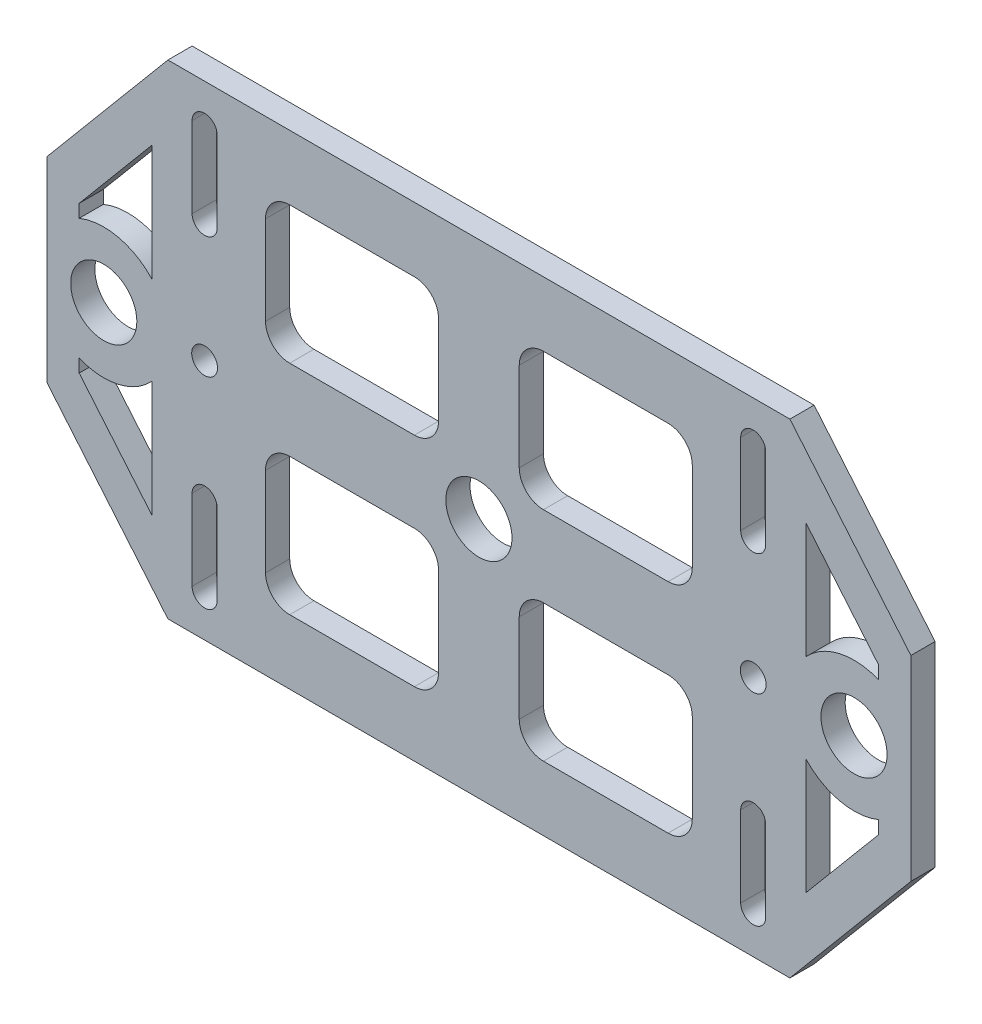
from build123d import *

# Parameters (mm, degrees)
SKETCH_1_W          = 77.1
SKETCH_1_H          = 60
SKETCH_1_R          = 4.1
SKETCH_1_R_2        = 1.6
SKETCH_1_W_2        = 3.1
SKETCH_1_H_2        = 10
EXTRUDE_1_DEPTH     = 3
SKETCH_2_R          = 1.55
SKETCH_2_W          = 21.45
SKETCH_2_H          = 17
CUT_EXTRUDE_1_DEPTH = 49.939784429
SKETCH_3_R          = 4.1
EXTRUDE_2_DEPTH     = 3
FILLET_1_R          = 3


with BuildPart() as part:
    # 草图1 → 凸台-拉伸1 (new body)
    with BuildSketch(Plane.XY):
        Rectangle(SKETCH_1_W, SKETCH_1_H)
        Circle(SKETCH_1_R, mode=Mode.SUBTRACT)
        with Locations((34, 0)):
            Circle(SKETCH_1_R_2, mode=Mode.SUBTRACT)
        with Locations((-34, 0)):
            Circle(SKETCH_1_R_2, mode=Mode.SUBTRACT)
        with Locations((34, -20)):
            Rectangle(SKETCH_1_W_2, SKETCH_1_H_2, mode=Mode.SUBTRACT)
        with Locations((-34, 20)):
            Rectangle(SKETCH_1_W_2, SKETCH_1_H_2, mode=Mode.SUBTRACT)
        with Locations((-34, -20)):
            Rectangle(SKETCH_1_W_2, SKETCH_1_H_2, mode=Mode.SUBTRACT)
        with Locations((34, 20)):
            Rectangle(SKETCH_1_W_2, SKETCH_1_H_2, mode=Mode.SUBTRACT)
    extrude(amount=EXTRUDE_1_DEPTH)

    # 草图2 → 切除-拉伸1 (cut, through all)
    with BuildSketch(Plane.XY.offset(3)):
        with Locations((-34, 25)):
            Circle(SKETCH_2_R)
        with Locations((-34, 15)):
            Circle(SKETCH_2_R)
        with Locations((34, 25)):
            Circle(SKETCH_2_R)
        with Locations((34, 15)):
            Circle(SKETCH_2_R)
        with Locations((34, -15)):
            Circle(SKETCH_2_R)
        with Locations((34, -25)):
            Circle(SKETCH_2_R)
        with Locations((-34, -15)):
            Circle(SKETCH_2_R)
        with Locations((-34, -25)):
            Circle(SKETCH_2_R)
        with Locations((-15.725, 13.5)):
            Rectangle(SKETCH_2_W, SKETCH_2_H)
        with Locations((15.725, 13.5)):
            Rectangle(SKETCH_2_W, SKETCH_2_H)
        with Locations((-15.725, -13.5)):
            Rectangle(SKETCH_2_W, SKETCH_2_H)
        with Locations((15.725, -13.5)):
            Rectangle(SKETCH_2_W, SKETCH_2_H)
    extrude(amount=-CUT_EXTRUDE_1_DEPTH, mode=Mode.SUBTRACT)

    # 草图3 → 凸台-拉伸2 (add)
    # profile 1 of 2: a face of its own
    with BuildSketch(Plane.XY.offset(3)):
        Polygon((-38.55, 30), (-53.55, 12.123696111), (-53.55, -12.123696111), (-38.55, -30), align=None)
        with Locations((-46.5, 0)):
            Circle(SKETCH_3_R, mode=Mode.SUBTRACT)
        with BuildLine():
            Line((-40.55, 19.837873681), (-49.55, 9.112091347))
            Line((-49.55, 9.112091347), (-49.55, 7.503832354))
            ThreePointArc((-49.55, 7.503832354), (-44.736420639, 7.905680732), (-40.55, 5.496135006))
            Line((-40.55, 5.496135006), (-40.55, 19.837873681))
        make_face(mode=Mode.SUBTRACT)
        with BuildLine():
            Line((-49.55, -7.503832354), (-49.55, -9.112091347))
            Line((-49.55, -9.112091347), (-40.55, -19.837873681))
            Line((-40.55, -19.837873681), (-40.55, -5.496135006))
            ThreePointArc((-40.55, -5.496135006), (-44.736420639, -7.905680732), (-49.55, -7.503832354))
        make_face(mode=Mode.SUBTRACT)
    # profile 2 of 2: a face of its own
    with BuildSketch(Plane.XY.offset(3)):
        Polygon((53.55, -12.123696111), (38.55, -30), (38.55, 30), (53.55, 12.123696111), align=None)
        with Locations(Location((46.5, 0, 0), (0, 0, 180))):
            Circle(SKETCH_3_R, mode=Mode.SUBTRACT)
        with BuildLine():
            Line((40.55, -19.837873681), (40.55, -5.496135006))
            ThreePointArc((40.55, -5.496135006), (44.736420639, -7.905680732), (49.55, -7.503832354))
            Line((49.55, -7.503832354), (49.55, -9.112091347))
            Line((49.55, -9.112091347), (40.55, -19.837873681))
        make_face(mode=Mode.SUBTRACT)
        with BuildLine():
            Line((40.55, 19.837873681), (49.55, 9.112091347))
            Line((49.55, 9.112091347), (49.55, 7.503832354))
            ThreePointArc((49.55, 7.503832354), (44.736420639, 7.905680732), (40.55, 5.496135006))
            Line((40.55, 5.496135006), (40.55, 19.837873681))
        make_face(mode=Mode.SUBTRACT)
    extrude(amount=-EXTRUDE_2_DEPTH)

    # 圆角1
    fillet_1_edges = [part.edges().sort_by_distance(p)[0] for p in [
        (26.45, 5, 1.5),
        (5, 5, 1.5),
        (5, 22, 1.5),
        (26.45, 22, 1.5),
        (-26.45, -22, 1.5),
        (-26.45, -5, 1.5),
        (-5, -5, 1.5),
        (-5, -22, 1.5),
        (26.45, -22, 1.5),
        (5, -22, 1.5),
        (5, -5, 1.5),
        (26.45, -5, 1.5),
        (-26.45, 5, 1.5),
        (-26.45, 22, 1.5),
        (-5, 22, 1.5),
        (-5, 5, 1.5),
    ]]
    fillet(fillet_1_edges, radius=FILLET_1_R)


solid = part.part
